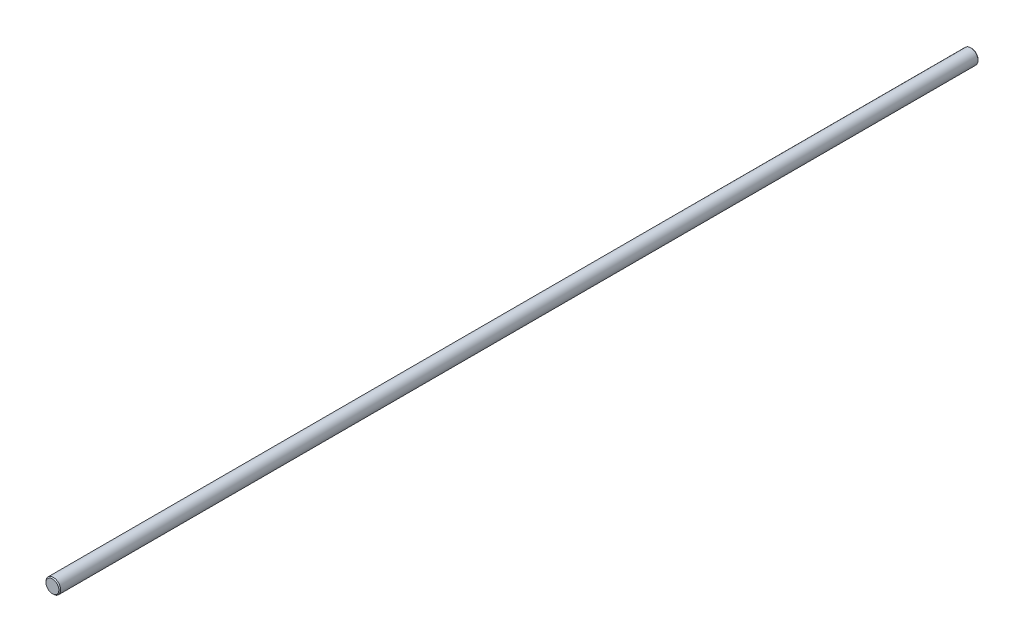
from build123d import *

# Parameters (mm, degrees)
SKETCH_1_R      = 4
EXTRUDE_1_DEPTH = 250
CHAMFER_1_SIZE  = 0.5


with BuildPart() as part:
    # 草图1 → 凸台-拉伸1 (new, symmetric)
    with BuildSketch(Plane.XY):
        Circle(SKETCH_1_R)
    extrude(amount=EXTRUDE_1_DEPTH, both=True)

    # 倒角1
    chamfer_1_edges = [part.edges().sort_by_distance(p)[0] for p in [
        (-4, 0, -250),
        (-4, 0, 250),
    ]]
    chamfer(chamfer_1_edges, length=CHAMFER_1_SIZE)


solid = part.part
